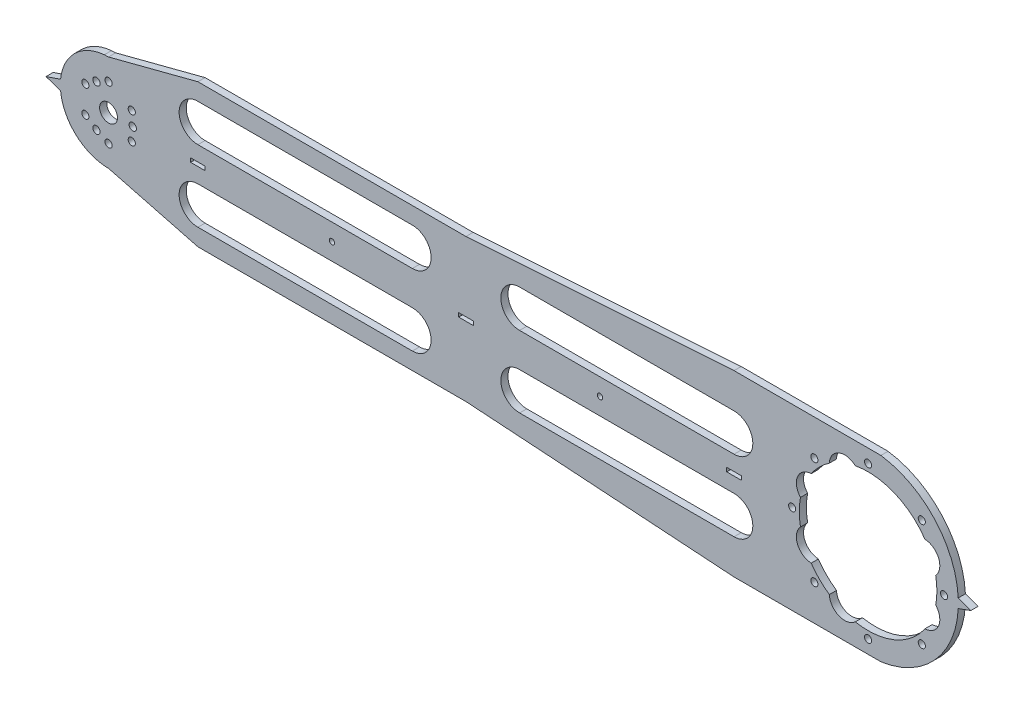
from build123d import *

# Parameters (mm, degrees)
SKETCH_1_R      = 2
SKETCH_1_R_2    = 2.05
SKETCH_1_R_3    = 5
SKETCH_1_R_4    = 1.5
SKETCH_1_W      = 8.2
SKETCH_1_H      = 2.2
EXTRUDE_1_DEPTH = 4


with BuildPart() as part:
    # 草图1 → 凸台-拉伸1 (new body)
    with BuildSketch(Plane.XY):
        with BuildLine():
            Line((0, 27), (50, 40))
            Line((50, 40), (200, 40))
            Line((200, 40), (350, 50))
            Line((350, 50), (425, 50))
            Line((425, 50), (432.177174038, 50))
            ThreePointArc((432.177174038, 50), (462.315665579, 34.04486642), (475.446907157, 2.573205287))
            Line((475.446907157, 2.573205287), (482.5, 0))
            Line((482.5, 0), (475.446907157, -2.572885974))
            ThreePointArc((475.446907157, -2.572885974), (462.321199465, -34.038799886), (432.193107325, -49.997710289))
            Line((432.193107325, -49.997710289), (425, -50))
            Line((425, -50), (350, -50))
            Line((350, -50), (200, -40))
            Line((200, -40), (50, -40))
            Line((50, -40), (0, -27))
            Line((0, -27), (-2.35435733, -26.897156013))
            ThreePointArc((-2.35435733, -26.897156013), (-18.941976287, -19.240621984), (-26.857038268, -2.774796472))
            Line((-26.857038268, -2.774796472), (-35, 0))
            Line((-35, 0), (-26.857038268, 2.774796472))
            ThreePointArc((-26.857038268, 2.774796472), (-18.941976287, 19.240621984), (-2.35435733, 26.897156013))
            Line((-2.35435733, 26.897156013), (0, 27))
        make_face()
        with Locations((0, -15)):
            Circle(SKETCH_1_R, mode=Mode.SUBTRACT)
        with Locations((-12.990381057, -7.5)):
            Circle(SKETCH_1_R, mode=Mode.SUBTRACT)
        with Locations((-12.990381057, 7.5)):
            Circle(SKETCH_1_R, mode=Mode.SUBTRACT)
        with Locations((0, 15)):
            Circle(SKETCH_1_R, mode=Mode.SUBTRACT)
        with Locations((12.990381057, 7.5)):
            Circle(SKETCH_1_R, mode=Mode.SUBTRACT)
        with Locations((12.990381057, -7.5)):
            Circle(SKETCH_1_R, mode=Mode.SUBTRACT)
        with Locations((13.53, 0)):
            Circle(SKETCH_1_R_2, mode=Mode.SUBTRACT)
        with Locations((-6.765, -11.717323713)):
            Circle(SKETCH_1_R_2, mode=Mode.SUBTRACT)
        with Locations((-6.765, 11.717323713)):
            Circle(SKETCH_1_R_2, mode=Mode.SUBTRACT)
        Circle(SKETCH_1_R_3, mode=Mode.SUBTRACT)
        with Locations((394.9479618, -30.0520382)):
            Circle(SKETCH_1_R, mode=Mode.SUBTRACT)
        with Locations((382.5, 0)):
            Circle(SKETCH_1_R, mode=Mode.SUBTRACT)
        with Locations((275, 0)):
            Circle(SKETCH_1_R_4, mode=Mode.SUBTRACT)
        with Locations((125, 0)):
            Circle(SKETCH_1_R_4, mode=Mode.SUBTRACT)
        with Locations((467.5, 0)):
            Circle(SKETCH_1_R, mode=Mode.SUBTRACT)
        with Locations((455.0520382, -30.0520382)):
            Circle(SKETCH_1_R, mode=Mode.SUBTRACT)
        with Locations((455.0520382, 30.0520382)):
            Circle(SKETCH_1_R, mode=Mode.SUBTRACT)
        with Locations((394.9479618, 30.0520382)):
            Circle(SKETCH_1_R, mode=Mode.SUBTRACT)
        with Locations((425, 42.502596008)):
            Circle(SKETCH_1_R, mode=Mode.SUBTRACT)
        with Locations((425, -42.502596008)):
            Circle(SKETCH_1_R, mode=Mode.SUBTRACT)
        with Locations((200, 0)):
            Rectangle(SKETCH_1_W, SKETCH_1_H, mode=Mode.SUBTRACT)
        with Locations((50, 0)):
            Rectangle(SKETCH_1_W, SKETCH_1_H, mode=Mode.SUBTRACT)
        with Locations((350, 0)):
            Rectangle(SKETCH_1_W, SKETCH_1_H, mode=Mode.SUBTRACT)
        with BuildLine():
            Line((50, 30.5), (170, 30.5))
            ThreePointArc((170, 30.5), (180.5, 20), (170, 9.5))
            Line((170, 9.5), (50, 9.5))
            ThreePointArc((50, 9.5), (39.5, 20), (50, 30.5))
        make_face(mode=Mode.SUBTRACT)
        with BuildLine():
            Line((350, 30.5), (230, 30.5))
            ThreePointArc((230, 30.5), (219.5, 20), (230, 9.5))
            Line((230, 9.5), (350, 9.5))
            ThreePointArc((350, 9.5), (360.5, 20), (350, 30.5))
        make_face(mode=Mode.SUBTRACT)
        with BuildLine():
            Line((50, -30.5), (170, -30.5))
            ThreePointArc((170, -30.5), (180.5, -20), (170, -9.5))
            Line((170, -9.5), (50, -9.5))
            ThreePointArc((50, -9.5), (39.5, -20), (50, -30.5))
        make_face(mode=Mode.SUBTRACT)
        with BuildLine():
            Line((350, -30.5), (230, -30.5))
            ThreePointArc((230, -30.5), (219.5, -20), (230, -9.5))
            Line((230, -9.5), (350, -9.5))
            ThreePointArc((350, -9.5), (360.5, -20), (350, -30.5))
        make_face(mode=Mode.SUBTRACT)
        with BuildLine():
            ThreePointArc((456.82141298, 21.671356116), (464.472060808, 16.350447926), (462.824918175, 7.178131028))
            ThreePointArc((462.824918175, 7.178131028), (463.499999997, 0.000487034), (462.825099773, -7.177174038))
            ThreePointArc((462.825099773, -7.177174038), (464.472474468, -16.34944926), (456.821961265, -21.670551014))
            ThreePointArc((456.821961265, -21.670551014), (446.106697854, -32.198715901), (432.178131028, -37.824918175))
            ThreePointArc((432.178131028, -37.824918175), (425.000487034, -38.499999997), (417.822825962, -37.825099773))
            ThreePointArc((417.822825962, -37.825099773), (408.65055074, -39.472474468), (403.329448986, -31.821961265))
            ThreePointArc((403.329448986, -31.821961265), (397.776733311, -27.223955458), (393.17858702, -21.671356116))
            ThreePointArc((393.17858702, -21.671356116), (385.527939192, -16.350447926), (387.175081825, -7.178131028))
            ThreePointArc((387.175081825, -7.178131028), (386.500000003, -0.000487034), (387.174900227, 7.177174038))
            ThreePointArc((387.174900227, 7.177174038), (385.527525532, 16.34944926), (393.178038735, 21.670551014))
            ThreePointArc((393.178038735, 21.670551014), (397.776044542, 27.223266689), (403.328643884, 31.82141298))
            ThreePointArc((403.328643884, 31.82141298), (408.649552074, 39.472060808), (417.821868972, 37.824918175))
            ThreePointArc((417.821868972, 37.824918175), (424.999512966, 38.499999997), (432.177174038, 37.825099773))
            ThreePointArc((432.177174038, 37.825099773), (446.105883206, 32.1992499), (456.82141298, 21.671356116))
        make_face(mode=Mode.SUBTRACT)
    extrude(amount=EXTRUDE_1_DEPTH)


solid = part.part
